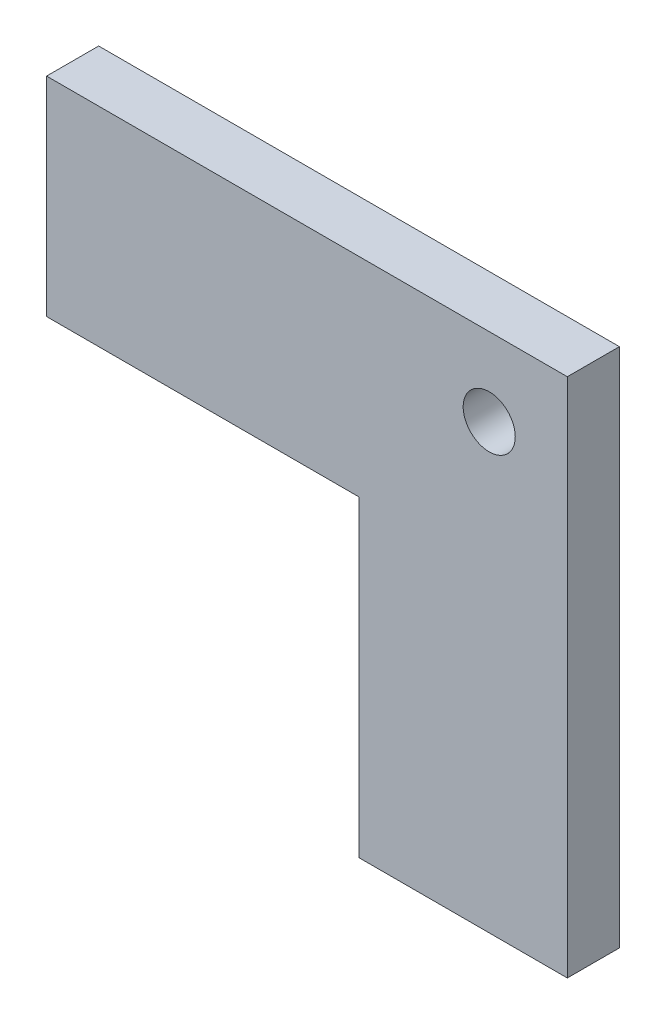
from build123d import *

# Parameters (mm, degrees)
SKETCH1_W               = 127
SKETCH1_H               = 127
BOSS_EXTRUDE1_DEPTH     = 12.7
CUT_EXTRUDE1_DEPTH      = 137.061310783
CUT_EXTRUDE1_DEPTH_BACK = 137.061310783
SKETCH3_W               = 76.2
SKETCH3_H               = 76.2
CUT_EXTRUDE2_DEPTH      = 137.061310783
CUT_EXTRUDE2_DEPTH_BACK = 137.061310783
SKETCH4_R               = 6.35


with BuildPart() as part:
    # Sketch1 → Boss-Extrude1 (new body)
    with BuildSketch(Plane.XY):
        with Locations((28.396629213, 36.030898876)):
            Rectangle(SKETCH1_W, SKETCH1_H)
    extrude(amount=-BOSS_EXTRUDE1_DEPTH)

    # Sketch3 → Cut-Extrude1 (cut, two sides: drawn at the far end of the back side and taken through both)
    with BuildSketch(Plane.XY.offset(-CUT_EXTRUDE1_DEPTH_BACK)):
        with Locations((2.996629213, 10.630898876)):
            Rectangle(SKETCH3_W, SKETCH3_H)
    extrude(amount=CUT_EXTRUDE1_DEPTH + CUT_EXTRUDE1_DEPTH_BACK, mode=Mode.SUBTRACT)

    # Sketch4 → Cut-Extrude2 (cut, two sides: drawn at the far end of the back side and taken through both)
    with BuildSketch(Plane.XY.offset(-CUT_EXTRUDE2_DEPTH_BACK)):
        with Locations((72.846629213, 80.480898876)):
            Circle(SKETCH4_R)
    extrude(amount=CUT_EXTRUDE2_DEPTH + CUT_EXTRUDE2_DEPTH_BACK, mode=Mode.SUBTRACT)


solid = part.part
